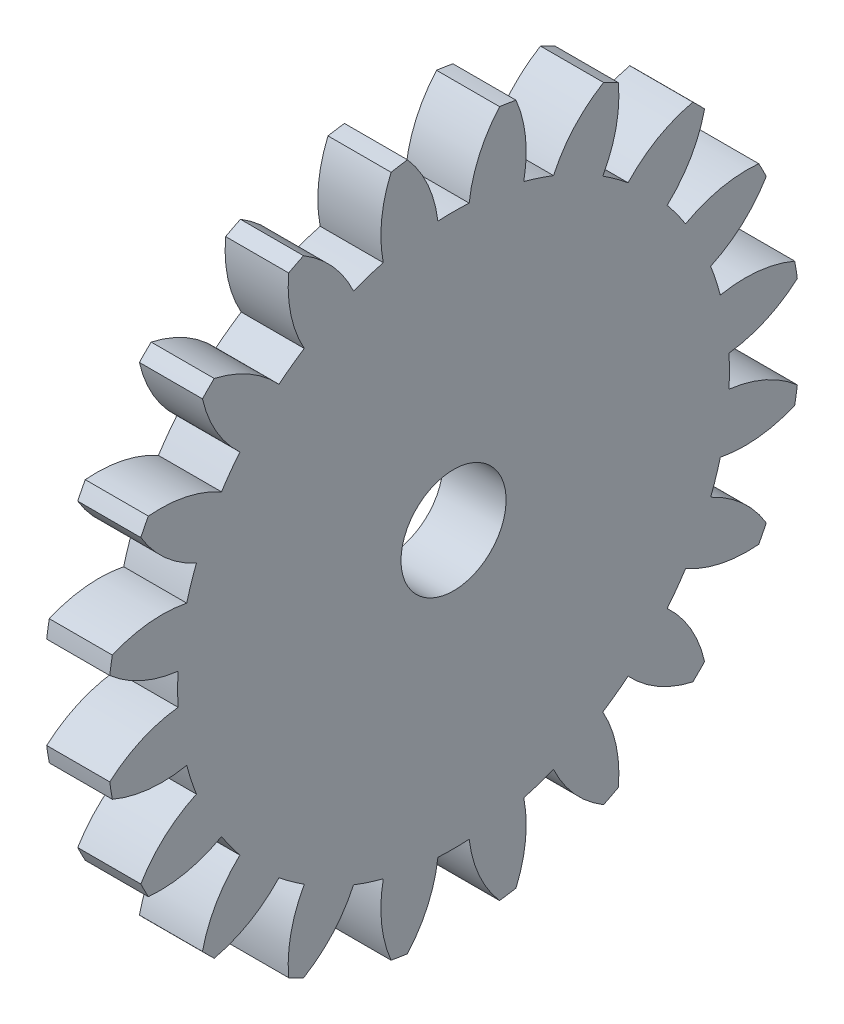
from build123d import *

# Parameters (mm, degrees)
BASPROSKE_W     = 3
BASPROSKE_H     = 16.5
TOOTHCUT_DEPTH  = 24.526580712
TEETHCUTS_COUNT = 20
TEETHCUTS_ANGLE = 342
BORSKE_R        = 2.5
BORE_DEPTH      = 50.0000508


with BuildPart() as part:
    # BasProSke → Base-Revolve (revolve)
    with BuildSketch(Plane(origin=(0, 0, 0), x_dir=(1, 0, 0), z_dir=(0, 1, 0)), mode=Mode.PRIVATE) as base_revolve_sk:
        with Locations((1.5, 8.25)):
            Rectangle(BASPROSKE_W, BASPROSKE_H)
    revolve(base_revolve_sk.sketch.rotate(Axis((-10, 0, 0), (1, 0, 0)), 180), axis=Axis((-10, 0, 0), (1, 0, 0)))

    # TooCutSke → ToothCut (cut, through all)
    with BuildSketch(Plane(origin=(0, 0, 0), x_dir=(0, 0, -1), z_dir=(1, 0, 0))):
        with BuildLine():
            ThreePointArc((0.74381438, 13.102904875), (0, 13.124), (-0.74381438, 13.102904875))
            ThreePointArc((-0.74381438, 13.102904875), (-1.226473103, 14.852072512), (-2.209965745, 16.376962373))
            ThreePointArc((-2.209965745, 16.376962373), (0, 16.5254), (2.209965745, 16.376962373))
            ThreePointArc((2.209965745, 16.376962373), (1.226473103, 14.852072512), (0.74381438, 13.102904875))
        make_face()
    toothcut = extrude(amount=TOOTHCUT_DEPTH, mode=Mode.SUBTRACT)

    # TeethCuts: ToothCut ×20 about axis
    teethcuts_axis = Axis((-10, 0, 0), (1, 0, 0))
    for i in range(1, TEETHCUTS_COUNT):
        add(toothcut.rotate(teethcuts_axis, i * TEETHCUTS_ANGLE / (TEETHCUTS_COUNT - 1)), mode=Mode.SUBTRACT)

    # BorSke → Bore (cut, symmetric)
    with BuildSketch(Plane(origin=(0, 0, 0), x_dir=(0, 0, -1), z_dir=(1, 0, 0))):
        with Locations(Location((0, 0, 0), (0, 0, 180))):
            Circle(BORSKE_R)
    extrude(amount=BORE_DEPTH, both=True, mode=Mode.SUBTRACT)


solid = part.part
